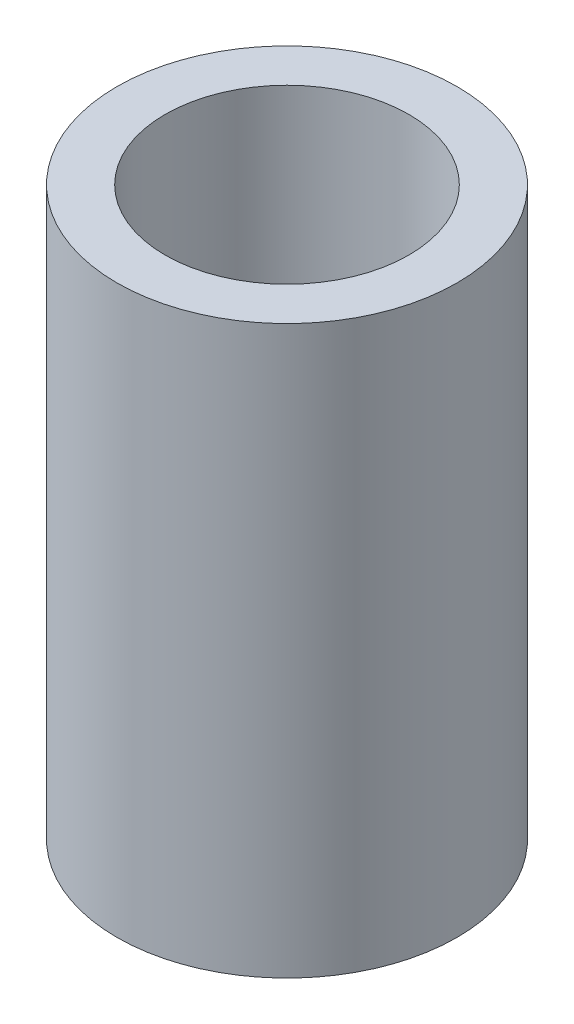
from build123d import *

# Parameters (mm, degrees)
CROQUIS1_R              = 6
CROQUIS1_R_2            = 4.3
SALIENTE_EXTRUIR1_DEPTH = 20


with BuildPart() as part:
    # Croquis1 → Saliente-Extruir1 (new body)
    with BuildSketch(Plane(origin=(0, 0, 0), x_dir=(1, 0, 0), z_dir=(0, 1, 0))):
        with Locations(Location((0, 0, 0), (0, 0, 270))):
            Circle(CROQUIS1_R)
        with Locations(Location((0, 0, 0), (0, 0, 270))):
            Circle(CROQUIS1_R_2, mode=Mode.SUBTRACT)
    extrude(amount=SALIENTE_EXTRUIR1_DEPTH)


solid = part.part
